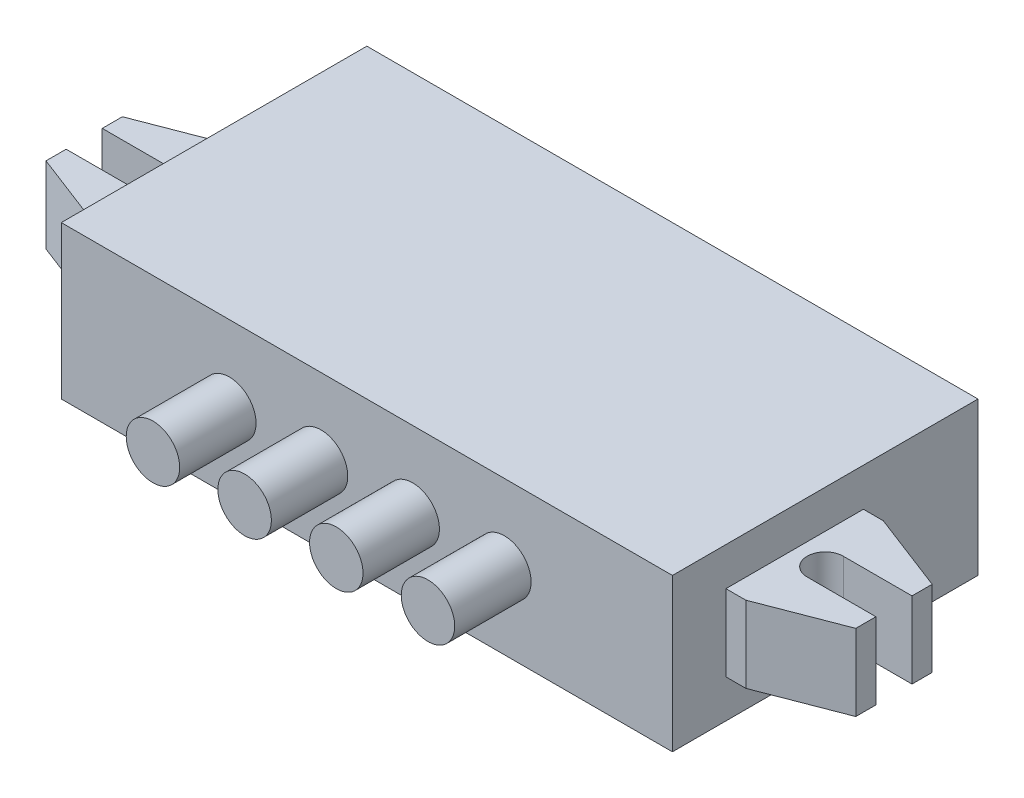
from build123d import *

# Parameters (mm, degrees)
SKETCH1_W           = 50.8
SKETCH1_H           = 25.4
BOSS_EXTRUDE1_DEPTH = 6.35
BOSS_EXTRUDE2_DEPTH = 3.175
SKETCH3_R           = 2.2225
BOSS_EXTRUDE3_DEPTH = 6.35


with BuildPart() as part:
    # Sketch1 → Boss-Extrude1 (new, symmetric)
    with BuildSketch(Plane(origin=(0, 0, 0), x_dir=(1, 0, 0), z_dir=(0, 1, 0))):
        Rectangle(SKETCH1_W, SKETCH1_H)
    extrude(amount=BOSS_EXTRUDE1_DEPTH, both=True)

    # Sketch2 → Boss-Extrude2 (add, symmetric)
    with BuildSketch(Plane(origin=(0, 0, 0), x_dir=(1, 0, 0), z_dir=(0, 1, 0))):
        with BuildLine():
            Line((-25.4, 3.175), (-27.051, 3.175))
            Line((-27.051, 3.175), (-33.655, 0.635))
            Line((-33.655, 0.635), (-33.655, -1.04))
            Line((-33.655, -1.04), (-27.94, -1.04))
            ThreePointArc((-27.94, -1.04), (-26.44, -2.54), (-27.94, -4.04))
            Line((-27.94, -4.04), (-33.655, -4.04))
            Line((-33.655, -4.04), (-33.655, -5.715))
            Line((-33.655, -5.715), (-27.051, -8.255))
            Line((-27.051, -8.255), (-25.4, -8.255))
            Line((-25.4, -8.255), (-25.4, 3.175))
        make_face()
        with BuildLine():
            Line((25.4, 3.175), (25.4, -8.255))
            Line((25.4, -8.255), (27.051, -8.255))
            Line((27.051, -8.255), (33.655, -5.715))
            Line((33.655, -5.715), (33.655, -4.04))
            Line((33.655, -4.04), (27.94, -4.04))
            ThreePointArc((27.94, -4.04), (26.44, -2.54), (27.94, -1.04))
            Line((27.94, -1.04), (33.655, -1.04))
            Line((33.655, -1.04), (33.655, 0.635))
            Line((33.655, 0.635), (27.051, 3.175))
            Line((27.051, 3.175), (25.4, 3.175))
        make_face()
    extrude(amount=BOSS_EXTRUDE2_DEPTH, both=True)

    # Sketch3 → Boss-Extrude3 (add, symmetric)
    with BuildSketch(Plane.XY.offset(12.7)):
        with Locations(Location((-3.81, 0, 0), (0, 0, 180))):
            Circle(SKETCH3_R)
        with Locations(Location((-11.43, 0, 0), (0, 0, 180))):
            Circle(SKETCH3_R)
        with Locations(Location((11.43, 0, 0), (0, 0, 180))):
            Circle(SKETCH3_R)
        with Locations(Location((3.81, 0, 0), (0, 0, 180))):
            Circle(SKETCH3_R)
    extrude(amount=BOSS_EXTRUDE3_DEPTH, both=True)


solid = part.part
